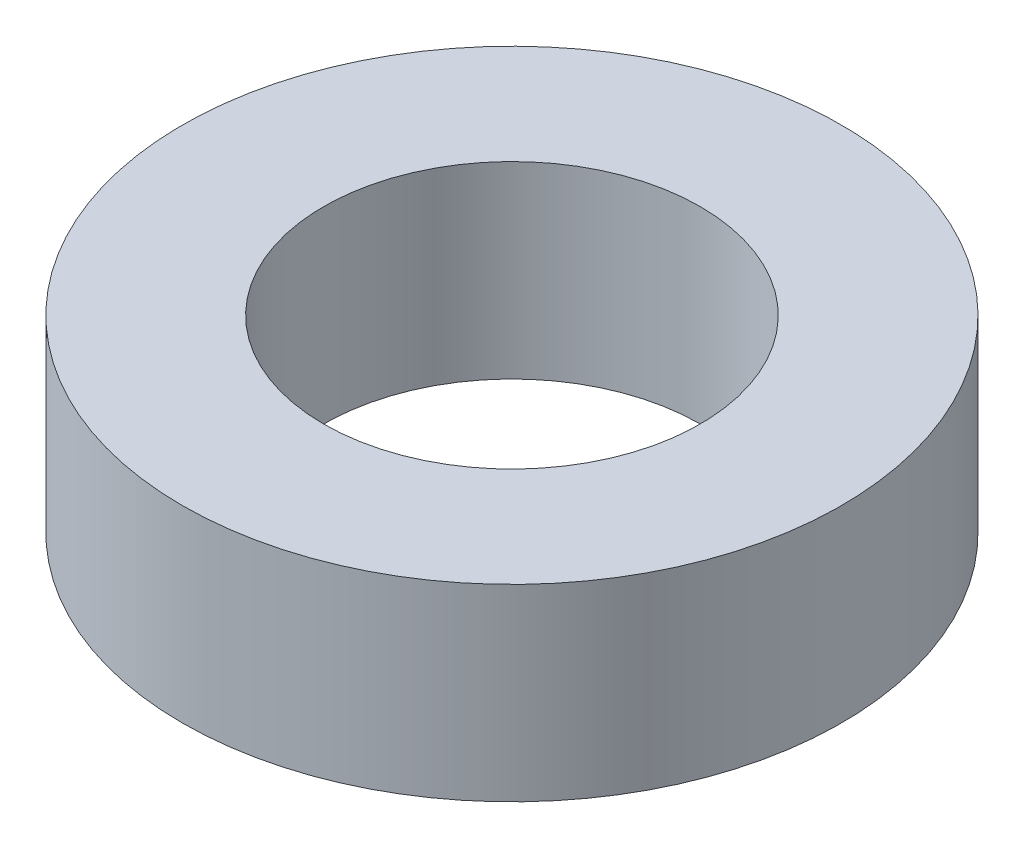
from build123d import *

# Parameters (mm, degrees)
SKIZZE1_R                       = 7
AUFSATZ_LINEAR_AUSTRAGEN1_DEPTH = 4
SKIZZE2_R                       = 4
SCHNITT_LINEAR_AUSTRAGEN1_DEPTH = 4


with BuildPart() as part:
    # Skizze1 → Aufsatz-Linear austragen1 (new body)
    with BuildSketch(Plane(origin=(0, 0, 0), x_dir=(1, 0, 0), z_dir=(0, 1, 0))):
        with Locations(Location((0, 0, 0), (0, 0, 270))):
            Circle(SKIZZE1_R)
    extrude(amount=AUFSATZ_LINEAR_AUSTRAGEN1_DEPTH)

    # Skizze2 → Schnitt-Linear austragen1 (cut)
    with BuildSketch(Plane(origin=(0, 4, 0), x_dir=(1, 0, 0), z_dir=(0, 1, 0))):
        with Locations(Location((0, 0, 0), (0, 0, 270))):
            Circle(SKIZZE2_R)
    extrude(amount=-SCHNITT_LINEAR_AUSTRAGEN1_DEPTH, mode=Mode.SUBTRACT)


solid = part.part
